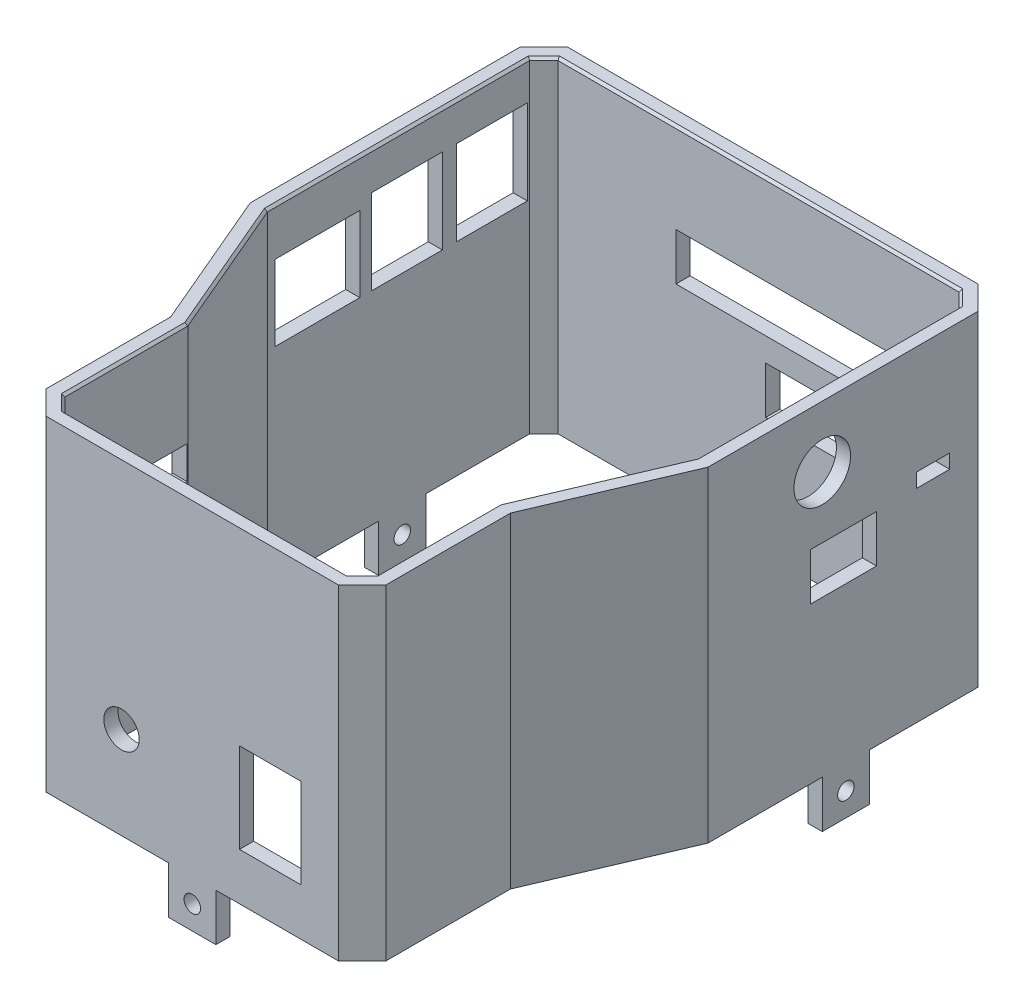
from build123d import *

# Parameters (mm, degrees)
BOSS_EXTRUDE2_DEPTH            = 69
CHAMFER1_SIZE                  = 3
CHAMFER2_SIZE                  = 5
SKETCH5_W                      = 10
SKETCH5_H                      = 3
SKETCH5_W_2                    = 3
SKETCH5_H_2                    = 10
BOSS_EXTRUDE3_DEPTH            = 10
SKETCH6_R                      = 1.75
CUT_EXTRUDE1_DEPTH             = 150.231363996
SKETCH7_R                      = 1.75
CUT_EXTRUDE2_DEPTH             = 150.13835858
CUT_EXTRUDE3_REACH             = 151.138
SKETCH8_W                      = 57
SKETCH8_H                      = 10
SKETCH8_W_2                    = 35
CUT_EXTRUDE4_REACH             = 151.231
SKETCH10_W                     = 15
SKETCH10_H                     = 18
SKETCH10_W_2                   = 18
SKETCH10_H_2                   = 16
CUT_EXTRUDE5_REACH             = 143.426
SKETCH12_W                     = 12
SKETCH12_H                     = 7
CUT_EXTRUDE5_DIRECTION_2_DEPTH = 142.425775586
CUT_EXTRUDE6_REACH             = 151.231
SKETCH14_R                     = 6
CUT_EXTRUDE7_REACH             = 151.138
SKETCH15_W                     = 13
SKETCH15_H                     = 19
CUT_EXTRUDE8_REACH             = 151.231
SKETCH16_W                     = 14
SKETCH16_H                     = 10
CUT_EXTRUDE9_REACH             = 151.231
SKETCH18_W                     = 7
SKETCH18_H                     = 3
CHAMFER3_SIZE                  = 0.5
CUT_EXTRUDE10_REACH            = 151.138
SKETCH19_R                     = 3.75


with BuildPart() as part:
    # Sketch4 → Boss-Extrude2 (new body)
    with BuildSketch(Plane(origin=(0, 0, 0), x_dir=(1, 0, 0), z_dir=(0, 1, 0))):
        Polygon((-48.5, 33), (48.5, 33), (48.5, -29.22455366), (36, -58.572379747), (36, -90), (-36, -90), (-36, -58.572379747), (-48.5, -29.22455366), align=None)
        Polygon((-45.5, 30), (45.5, 30), (45.5, -28.61227683), (33, -57.960102917), (33, -87), (-33, -87), (-33, -57.960102917), (-45.5, -28.61227683), align=None, mode=Mode.SUBTRACT)
    extrude(amount=BOSS_EXTRUDE2_DEPTH)

    # Chamfer1
    chamfer1_edges = [part.edges().sort_by_distance(p)[0] for p in [
        (-45.5, 34.5, -30),
        (-33, 34.5, 87),
        (33, 34.5, 87),
        (45.5, 34.5, -30),
    ]]
    chamfer(chamfer1_edges, length=CHAMFER1_SIZE)

    # Chamfer2
    chamfer2_edges = [part.edges().sort_by_distance(p)[0] for p in [
        (-48.5, 34.5, -33),
        (48.5, 34.5, -33),
        (36, 34.5, 90),
        (-36, 34.5, 90),
    ]]
    chamfer(chamfer2_edges, length=CHAMFER2_SIZE)

    # Sketch5 → Boss-Extrude3 (add)
    with BuildSketch(Plane(origin=(0, 0, 0), x_dir=(1, 0, 0), z_dir=(0, 1, 0))):
        with Locations((0, 31.5)):
            Rectangle(SKETCH5_W, SKETCH5_H)
        with Locations((-47, 0)):
            Rectangle(SKETCH5_W_2, SKETCH5_H_2)
        with Locations((0, -88.5)):
            Rectangle(SKETCH5_W, SKETCH5_H)
        with Locations((47, 0)):
            Rectangle(SKETCH5_W_2, SKETCH5_H_2)
    extrude(amount=-BOSS_EXTRUDE3_DEPTH)

    # Sketch6 → Cut-Extrude1 (cut, through all)
    with BuildSketch(Plane.ZY.offset(48.5)):
        with Locations((0, -5)):
            Circle(SKETCH6_R)
    extrude(amount=-CUT_EXTRUDE1_DEPTH, mode=Mode.SUBTRACT)

    # Sketch7 → Cut-Extrude2 (cut, through all)
    with BuildSketch(Plane(origin=(0, 0, -33), x_dir=(-1, 0, 0), z_dir=(0, 0, -1))):
        with Locations((0, -5)):
            Circle(SKETCH7_R)
    extrude(amount=-CUT_EXTRUDE2_DEPTH, mode=Mode.SUBTRACT)

    # Sketch8 → Cut-Extrude3 (cut, up to next)
    with BuildSketch(Plane(origin=(0, 0, -33), x_dir=(-1, 0, 0), z_dir=(0, 0, -1)), mode=Mode.PRIVATE) as cut_extrude3_sk1:
        with Locations((-11, 45)):
            Rectangle(SKETCH8_W, SKETCH8_H)
    cut_extrude3_tool1 = extrude(cut_extrude3_sk1.sketch, amount=-CUT_EXTRUDE3_REACH, mode=Mode.PRIVATE) & part.part
    # Sketch8 → Cut-Extrude3 (cut, up to next)
    with BuildSketch(Plane(origin=(0, 0, -33), x_dir=(-1, 0, 0), z_dir=(0, 0, -1)), mode=Mode.PRIVATE) as cut_extrude3_sk2:
        with Locations((-19, 30)):
            Rectangle(SKETCH8_W_2, SKETCH8_H)
    cut_extrude3_tool2 = extrude(cut_extrude3_sk2.sketch, amount=-CUT_EXTRUDE3_REACH, mode=Mode.PRIVATE) & part.part
    add(cut_extrude3_tool1.solids().sort_by_distance((11, 45, -33))[0], mode=Mode.SUBTRACT)
    add(cut_extrude3_tool2.solids().sort_by_distance((19, 30, -33))[0], mode=Mode.SUBTRACT)

    # Sketch10 → Cut-Extrude4 (cut, up to next)
    with BuildSketch(Plane.ZY.offset(48.5), mode=Mode.PRIVATE) as cut_extrude4_sk1:
        with Locations((-19, 52)):
            Rectangle(SKETCH10_W, SKETCH10_H)
    cut_extrude4_tool1 = extrude(cut_extrude4_sk1.sketch, amount=-CUT_EXTRUDE4_REACH, mode=Mode.PRIVATE) & part.part
    # Sketch10 → Cut-Extrude4 (cut, up to next)
    with BuildSketch(Plane.ZY.offset(48.5), mode=Mode.PRIVATE) as cut_extrude4_sk2:
        with Locations((-1, 52)):
            Rectangle(SKETCH10_W, SKETCH10_H)
    cut_extrude4_tool2 = extrude(cut_extrude4_sk2.sketch, amount=-CUT_EXTRUDE4_REACH, mode=Mode.PRIVATE) & part.part
    # Sketch10 → Cut-Extrude4 (cut, up to next)
    with BuildSketch(Plane.ZY.offset(48.5), mode=Mode.PRIVATE) as cut_extrude4_sk3:
        with Locations((18, 51)):
            Rectangle(SKETCH10_W_2, SKETCH10_H_2)
    cut_extrude4_tool3 = extrude(cut_extrude4_sk3.sketch, amount=-CUT_EXTRUDE4_REACH, mode=Mode.PRIVATE) & part.part
    add(cut_extrude4_tool1.solids().sort_by_distance((-48.5, 52, -19))[0], mode=Mode.SUBTRACT)
    add(cut_extrude4_tool2.solids().sort_by_distance((-48.5, 52, -1))[0], mode=Mode.SUBTRACT)
    add(cut_extrude4_tool3.solids().sort_by_distance((-48.5, 51, 18))[0], mode=Mode.SUBTRACT)

    # Sketch12 → Cut-Extrude5 (cut, up to next)
    with BuildSketch(Plane.ZY.offset(36), mode=Mode.PRIVATE) as cut_extrude5_sk1:
        with Locations((64.072379747, 43.5)):
            Rectangle(SKETCH12_W, SKETCH12_H)
    cut_extrude5_tool1 = extrude(cut_extrude5_sk1.sketch, amount=-CUT_EXTRUDE5_REACH, mode=Mode.PRIVATE) & part.part
    add(cut_extrude5_tool1.solids().sort_by_distance((-36, 43.5, 64.07238))[0], mode=Mode.SUBTRACT)

    # Sketch12 → Cut-Extrude5 direction 2 (cut)
    with BuildSketch(Plane.ZY.offset(36)):
        with Locations((64.072379747, 43.5)):
            Rectangle(SKETCH12_W, SKETCH12_H)
    extrude(amount=CUT_EXTRUDE5_DIRECTION_2_DEPTH, mode=Mode.SUBTRACT)

    # Sketch14 → Cut-Extrude6 (cut, up to next)
    with BuildSketch(Plane(origin=(48.5, 0, 0), x_dir=(0, 0, -1), z_dir=(1, 0, 0)), mode=Mode.PRIVATE) as cut_extrude6_sk1:
        with Locations((-5, 56)):
            Circle(SKETCH14_R)
    cut_extrude6_tool1 = extrude(cut_extrude6_sk1.sketch, amount=-CUT_EXTRUDE6_REACH, mode=Mode.PRIVATE) & part.part
    add(cut_extrude6_tool1.solids().sort_by_distance((48.5, 56, 5))[0], mode=Mode.SUBTRACT)

    # Sketch15 → Cut-Extrude7 (cut, up to next)
    with BuildSketch(Plane.XY.offset(90), mode=Mode.PRIVATE) as cut_extrude7_sk1:
        with Locations((16.5, 19.5)):
            Rectangle(SKETCH15_W, SKETCH15_H)
    cut_extrude7_tool1 = extrude(cut_extrude7_sk1.sketch, amount=-CUT_EXTRUDE7_REACH, mode=Mode.PRIVATE) & part.part
    add(cut_extrude7_tool1.solids().sort_by_distance((16.5, 19.5, 90))[0], mode=Mode.SUBTRACT)

    # Sketch16 → Cut-Extrude8 (cut, up to next)
    with BuildSketch(Plane(origin=(48.5, 0, 0), x_dir=(0, 0, -1), z_dir=(1, 0, 0)), mode=Mode.PRIVATE) as cut_extrude8_sk1:
        with Locations((-0.5, 38)):
            Rectangle(SKETCH16_W, SKETCH16_H)
    cut_extrude8_tool1 = extrude(cut_extrude8_sk1.sketch, amount=-CUT_EXTRUDE8_REACH, mode=Mode.PRIVATE) & part.part
    add(cut_extrude8_tool1.solids().sort_by_distance((48.5, 38, 0.5))[0], mode=Mode.SUBTRACT)

    # Sketch18 → Cut-Extrude9 (cut, up to next)
    with BuildSketch(Plane(origin=(48.5, 0, 0), x_dir=(0, 0, -1), z_dir=(1, 0, 0)), mode=Mode.PRIVATE) as cut_extrude9_sk1:
        with Locations((18.5, 44.5)):
            Rectangle(SKETCH18_W, SKETCH18_H)
    cut_extrude9_tool1 = extrude(cut_extrude9_sk1.sketch, amount=-CUT_EXTRUDE9_REACH, mode=Mode.PRIVATE) & part.part
    add(cut_extrude9_tool1.solids().sort_by_distance((48.5, 44.5, -18.5))[0], mode=Mode.SUBTRACT)

    # Chamfer3
    chamfer3_edges = [part.edges().sort_by_distance(p)[0] for p in [
        (-39.25, 69, 43.286189873),
        (-33, 69, 70.980051458),
        (39.25, 69, 43.286189873),
        (45.5, 69, 0.806138415),
        (0, 69, 87),
        (33, 69, 70.980051458),
        (0, 69, -30),
        (-45.5, 69, 0.806138415),
        (-31.5, 69, 85.5),
        (31.5, 69, 85.5),
        (44, 69, -28.5),
        (-44, 69, -28.5),
    ]]
    chamfer(chamfer3_edges, length=CHAMFER3_SIZE)

    # Sketch19 → Cut-Extrude10 (cut, up to next)
    with BuildSketch(Plane.XY.offset(90), mode=Mode.PRIVATE) as cut_extrude10_sk1:
        with Locations((-15, 19.5)):
            Circle(SKETCH19_R)
    cut_extrude10_tool1 = extrude(cut_extrude10_sk1.sketch, amount=-CUT_EXTRUDE10_REACH, mode=Mode.PRIVATE) & part.part
    add(cut_extrude10_tool1.solids().sort_by_distance((-15, 19.5, 90))[0], mode=Mode.SUBTRACT)


solid = part.part
